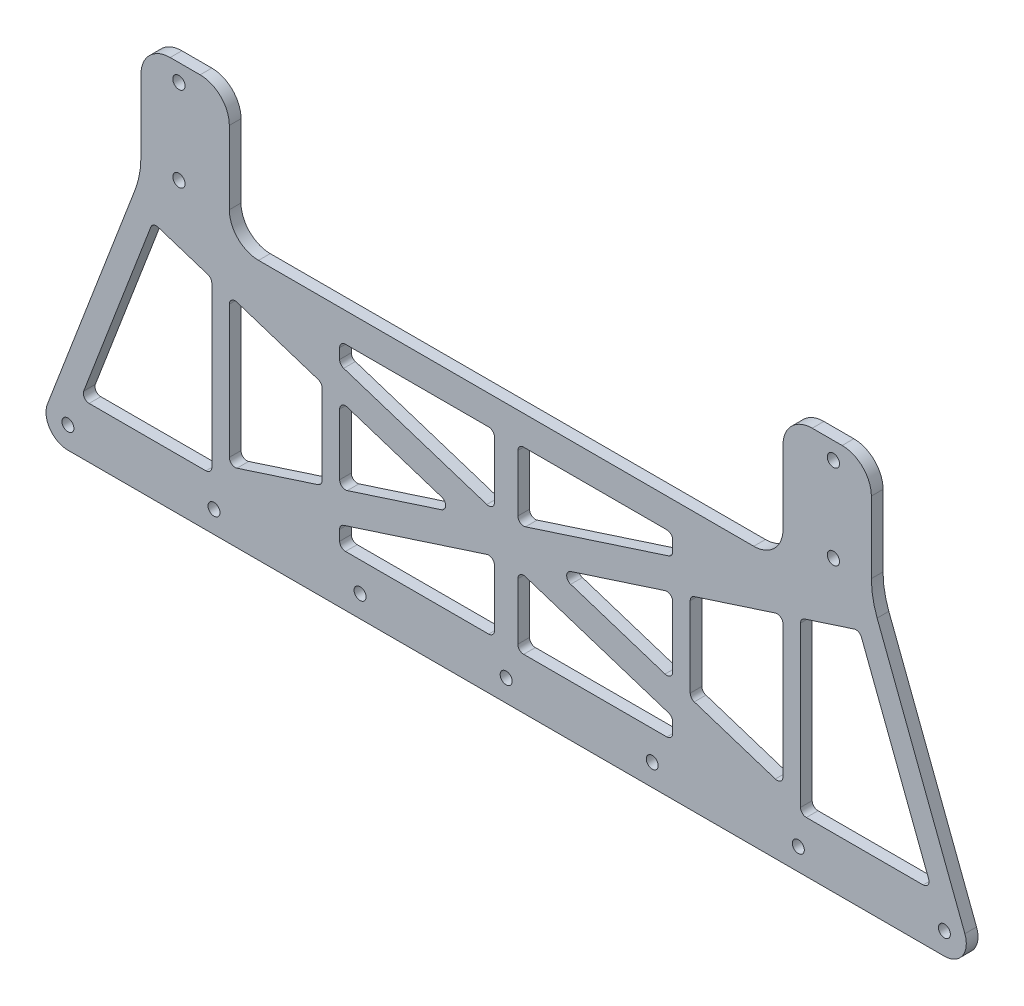
from build123d import *

# Parameters (mm, degrees)
SKETCH_1_W           = 250
SKETCH_1_H           = 140
EXTRUDE_1_DEPTH      = 4
SKETCH_2_R           = 1.55
CUT_EXTRUDE_1_DEPTH  = 4
SKETCH_4_W           = 350
SKETCH_4_H           = 30
EXTRUDE_2_DEPTH      = 4
EXTRUDE_3_DEPTH      = 4
SKETCH_3_R           = 2.05
CUT_EXTRUDE_2_DEPTH  = 4
SKETCH_6_W           = 189.5
SKETCH_6_H           = 45
CUT_EXTRUDE_3_DEPTH  = 4
CUT_EXTRUDE_4_DEPTH  = 4
CUT_EXTRUDE_5_DEPTH  = 4
FILLET_1_R           = 10
CUT_EXTRUDE_6_DEPTH  = 4
CUT_EXTRUDE_7_DEPTH  = 4
FILLET_2_R           = 2
FILLET_3_R           = 10
FILLET_4_R           = 30
SKETCH_11_R          = 1.55
EXTRUDE_4_DEPTH      = 4
EXTRUDE_START        = -4
EXTRUDE_5_DEPTH      = 4
SKETCH_13_R          = 2.1
CUT_EXTRUDE_12_DEPTH = 4
FILLET_5_R           = 2


with BuildPart() as part:
    # 草图1 → 凸台-拉伸1 (new body)
    with BuildSketch(Plane.XY):
        Rectangle(SKETCH_1_W, SKETCH_1_H)
    extrude(amount=EXTRUDE_1_DEPTH)

    # 草图2 → 切除-拉伸1 (cut)
    with BuildSketch(Plane.XY.offset(4)):
        with Locations((-108.75, 65)):
            Circle(SKETCH_2_R)
        with Locations((-108.75, 38.2)):
            Circle(SKETCH_2_R)
        with Locations((108.75, 65)):
            Circle(SKETCH_2_R)
        with Locations((108.75, 38.2)):
            Circle(SKETCH_2_R)
    extrude(amount=-CUT_EXTRUDE_1_DEPTH, mode=Mode.SUBTRACT)

    # 草图4 → 凸台-拉伸2 (add)
    with BuildSketch(Plane.XY.offset(4)):
        with Locations((0, -55)):
            Rectangle(SKETCH_4_W, SKETCH_4_H)
    extrude(amount=-EXTRUDE_2_DEPTH)

    # 草图5 → 凸台-拉伸3 (add)
    with BuildSketch(Plane.XY.offset(4)):
        Polygon((-125, -40), (-125, 70), (-175, -40), align=None)
        Polygon((175, -40), (125, 70), (125, -40), align=None)
    extrude(amount=-EXTRUDE_3_DEPTH)

    # 草图3 → 切除-拉伸2 (cut)
    with BuildSketch(Plane.XY.offset(4)):
        with Locations((50, -56.4)):
            Circle(SKETCH_3_R)
        with Locations((0, -56.4)):
            Circle(SKETCH_3_R)
        with Locations((100, -56.4)):
            Circle(SKETCH_3_R)
        with Locations((150, -56.4)):
            Circle(SKETCH_3_R)
        with Locations((-50, -56.4)):
            Circle(SKETCH_3_R)
        with Locations((-100, -56.4)):
            Circle(SKETCH_3_R)
        with Locations((-150, -56.4)):
            Circle(SKETCH_3_R)
    extrude(amount=-CUT_EXTRUDE_2_DEPTH, mode=Mode.SUBTRACT)

    # 草图6 → 切除-拉伸3 (cut)
    with BuildSketch(Plane.XY.offset(4)):
        with Locations((0, 47.5)):
            Rectangle(SKETCH_6_W, SKETCH_6_H)
    extrude(amount=-CUT_EXTRUDE_3_DEPTH, mode=Mode.SUBTRACT)

    # 草图7 → 切除-拉伸4 (cut)
    with BuildSketch(Plane.XY.offset(4)):
        Polygon((-125, 70), (-125, 30), (-175, -40), align=None)
        Polygon((175, -40), (125, 70), (125, 30), align=None)
    extrude(amount=-CUT_EXTRUDE_4_DEPTH, mode=Mode.SUBTRACT)

    # 草图8 → 切除-拉伸5 (cut)
    with BuildSketch(Plane.XY.offset(4)):
        with BuildLine():
            Line((-150, -63.9), (150, -63.9))
            ThreePointArc((150, -63.9), (156.178018616, -60.652303609), (157.005549561, -53.721889595))
            Line((157.005549561, -53.721889595), (125, 30))
            Line((125, 30), (228.155592589, 30))
            Line((228.155592589, 30), (175, -70))
            Line((175, -70), (-175, -70))
            Line((-175, -70), (-228.155592589, 30))
            Line((-228.155592589, 30), (-125, 30))
            Line((-125, 30), (-157.005549561, -53.721889595))
            ThreePointArc((-157.005549561, -53.721889595), (-156.178018616, -60.652303609), (-150, -63.9))
        make_face()
    extrude(amount=-CUT_EXTRUDE_5_DEPTH, mode=Mode.SUBTRACT)

    # 圆角1
    fillet_1_edges = [part.edges().sort_by_distance(p)[0] for p in [
        (94.75, 25, 2),
        (-94.75, 25, 2),
    ]]
    fillet(fillet_1_edges, radius=FILLET_1_R)

    # 草图9 → 切除-拉伸6 (cut)
    with BuildSketch(Plane.XY.offset(4)):
        Polygon((-57, -39.42450978), (-57, -46.4), (-4, -46.4), (-4, -22.251950414), align=None)
        Polygon((-57, -2.487306614), (-57, -28.912693386), (-16.221410479, -15.7), align=None)
        Polygon((-57, 15), (-57, 8.02450978), (-4, -9.148049586), (-4, 15), align=None)
        Polygon((4, 15), (4, -9.148049586), (57, 8.02450978), (57, 15), align=None)
        Polygon((16.221410479, -15.7), (57, -28.912693386), (57, -2.487306614), align=None)
        Polygon((4, -22.251950414), (4, -46.4), (57, -46.4), (57, -39.42450978), align=None)
        Polygon((63, -0.54324329), (63, -30.85675671), (94.75, -41.144091803), (94.75, 9.744091803), align=None)
        Polygon((-94.75, -41.144091803), (-63, -30.85675671), (-63, -0.54324329), (-94.75, 9.744091803), align=None)
    extrude(amount=-CUT_EXTRUDE_6_DEPTH, mode=Mode.SUBTRACT)

    # 草图10 → 切除-拉伸7 (cut)
    with BuildSketch(Plane.XY.offset(4)):
        Polygon((-100.75, 28.2), (-100.75, -46.4), (-145.641868809, -46.4), (-117.123472857, 28.2), align=None)
        Polygon((117.123472857, 28.2), (100.75, 28.2), (100.75, -46.4), (145.641868809, -46.4), align=None)
    extrude(amount=-CUT_EXTRUDE_7_DEPTH, mode=Mode.SUBTRACT)

    # 圆角2
    fillet_2_edges = [part.edges().sort_by_distance(p)[0] for p in [
        (-57, 15, 2),
        (-4, 15, 2),
        (-4, -9.148049586, 2),
        (-57, 8.02450978, 2),
        (-57, -2.487306614, 2),
        (-16.221410479, -15.7, 2),
        (-57, -28.912693386, 2),
        (57, -2.487306614, 2),
        (57, -28.912693386, 2),
        (16.221410479, -15.7, 2),
        (57, 15, 2),
        (57, 8.02450978, 2),
        (4, -9.148049586, 2),
        (4, 15, 2),
        (57, -39.42450978, 2),
        (57, -46.4, 2),
        (4, -46.4, 2),
        (4, -22.251950414, 2),
        (63, -0.54324329, 2),
        (94.75, 9.744091803, 2),
        (94.75, -41.144091803, 2),
        (63, -30.85675671, 2),
        (-63, -0.54324329, 2),
        (-63, -30.85675671, 2),
        (-94.75, -41.144091803, 2),
        (-94.75, 9.744091803, 2),
        (-57, -39.42450978, 2),
        (-4, -22.251950414, 2),
        (-4, -46.4, 2),
        (-57, -46.4, 2),
        (-100.75, -46.4, 2),
        (-145.641868809, -46.4, 2),
        (-117.123472857, 28.2, 2),
        (-100.75, 28.2, 2),
        (117.123472857, 28.2, 2),
        (145.641868809, -46.4, 2),
        (100.75, -46.4, 2),
        (100.75, 28.2, 2),
    ]]
    fillet(fillet_2_edges, radius=FILLET_2_R)

    # 圆角3
    fillet_3_edges = [part.edges().sort_by_distance(p)[0] for p in [
        (-94.75, 70, 2),
        (94.75, 70, 2),
        (-125, 70, 2),
        (125, 70, 2),
    ]]
    fillet(fillet_3_edges, radius=FILLET_3_R)

    # 圆角4
    fillet_4_edges = [part.edges().sort_by_distance(p)[0] for p in [
        (-125, 30, 2),
        (125, 30, 2),
    ]]
    fillet(fillet_4_edges, radius=FILLET_4_R)

    # 草图11 → 凸台-拉伸4 (add)
    with BuildSketch(Plane.XY.offset(4)):
        with Locations((108.75, 38.2)):
            Circle(SKETCH_11_R)
        with Locations((108.75, 65)):
            Circle(SKETCH_11_R)
        with Locations((-108.75, 38.2)):
            Circle(SKETCH_11_R)
        with Locations((-108.75, 65)):
            Circle(SKETCH_11_R)
    extrude(amount=-EXTRUDE_4_DEPTH)

    # 草图14 → 凸台-拉伸5 (add)
    with BuildSketch(Plane.XY.offset(4).offset(EXTRUDE_START)):
        with BuildLine():
            Line((100.75, 11.688155127), (120.935438111, 18.228450114))
            Line((120.935438111, 18.228450114), (117.61502802, 26.914162775))
            ThreePointArc((117.61502802, 26.914162775), (116.880829099, 27.847471631), (115.74688147, 28.2))
            Line((115.74688147, 28.2), (102.75, 28.2))
            ThreePointArc((102.75, 28.2), (101.335786438, 27.614213562), (100.75, 26.2))
            Line((100.75, 26.2), (100.75, 11.688155127))
        make_face()
        with BuildLine():
            Line((-100.75, 26.2), (-100.75, 11.688155127))
            Line((-100.75, 11.688155127), (-120.935438111, 18.228450114))
            Line((-120.935438111, 18.228450114), (-117.61502802, 26.914162775))
            ThreePointArc((-117.61502802, 26.914162775), (-116.880829099, 27.847471631), (-115.74688147, 28.2))
            Line((-115.74688147, 28.2), (-102.75, 28.2))
            ThreePointArc((-102.75, 28.2), (-101.335786438, 27.614213562), (-100.75, 26.2))
        make_face()
    extrude(amount=EXTRUDE_5_DEPTH)

    # 草图13 → 切除-拉伸12 (cut)
    with BuildSketch(Plane.XY.offset(4)):
        with Locations((112, 35.1)):
            Circle(SKETCH_13_R)
        with Locations((112, 64.1)):
            Circle(SKETCH_13_R)
        with Locations(Location((-112, 64.1, 0), (0, 0, 180))):
            Circle(SKETCH_13_R)
        with Locations(Location((-112, 35.1, 0), (0, 0, 180))):
            Circle(SKETCH_13_R)
    extrude(amount=-CUT_EXTRUDE_12_DEPTH, mode=Mode.SUBTRACT)

    # 圆角5
    fillet_5_edges = [part.edges().sort_by_distance(p)[0] for p in [
        (120.935438111, 18.228450114, 2),
        (100.75, 11.688155127, 2),
        (-120.935438111, 18.228450114, 2),
        (-100.75, 11.688155127, 2),
    ]]
    fillet(fillet_5_edges, radius=FILLET_5_R)


solid = part.part
